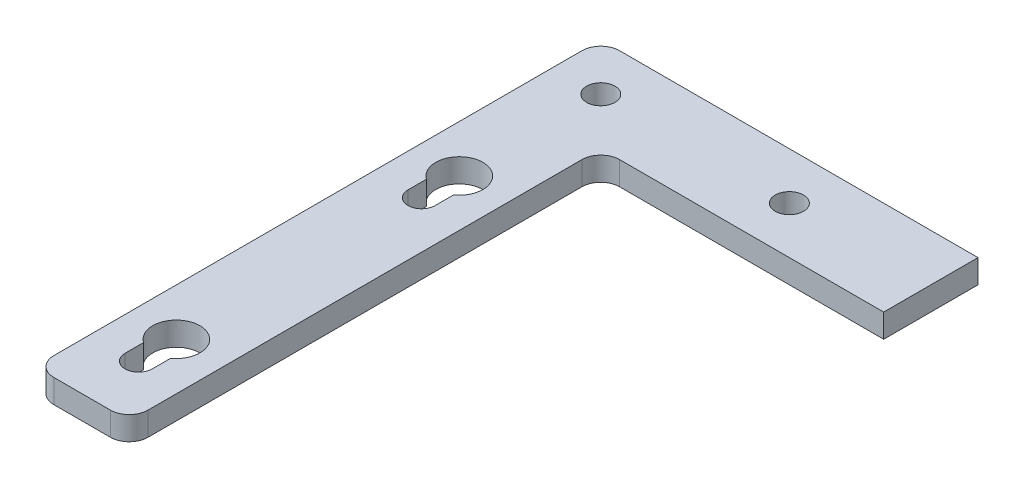
from build123d import *

# Parameters (mm, degrees)
BOSS_EXTRUDE1_DEPTH = 3.175
SKETCH2_R           = 1.905
CUT_EXTRUDE1_DEPTH  = 3.175
FILLET3_R           = 2.54


with BuildPart() as part:
    # Sketch1 → Boss-Extrude1 (new body)
    with BuildSketch(Plane(origin=(0, 0, 0), x_dir=(1, 0, 0), z_dir=(0, 1, 0))):
        Polygon((0, 76.2), (0, 0), (12.7, 0), (12.7, 63.5), (50.8, 63.5), (50.8, 76.2), align=None)
    extrude(amount=BOSS_EXTRUDE1_DEPTH)

    # Sketch2 → Cut-Extrude1 (cut)
    with BuildSketch(Plane(origin=(0, 3.175, 0), x_dir=(1, 0, 0), z_dir=(0, 1, 0))):
        with BuildLine():
            Line((4.5212, 48.204597226), (4.5212, 45.72))
            ThreePointArc((4.5212, 45.72), (6.35, 43.8912), (8.1788, 45.72))
            Line((8.1788, 45.72), (8.1788, 48.204597226))
            ThreePointArc((8.1788, 48.204597226), (6.35, 53.975), (4.5212, 48.204597226))
        make_face()
        with BuildLine():
            Line((4.5212, 10.104597226), (4.5212, 7.62))
            ThreePointArc((4.5212, 7.62), (6.35, 5.7912), (8.1788, 7.62))
            Line((8.1788, 7.62), (8.1788, 10.104597226))
            ThreePointArc((8.1788, 10.104597226), (6.35, 15.875), (4.5212, 10.104597226))
        make_face()
        with Locations(Location((31.75, 69.85, 0), (0, 0, 270))):
            Circle(SKETCH2_R)
        with Locations(Location((6.35, 69.85, 0), (0, 0, 270))):
            Circle(SKETCH2_R)
    extrude(amount=-CUT_EXTRUDE1_DEPTH, mode=Mode.SUBTRACT)

    # Fillet3
    fillet3_edges = [part.edges().sort_by_distance(p)[0] for p in [
        (12.7, 1.5875, -63.5),
        (12.7, 1.5875, 0),
        (0, 1.5875, 0),
        (0, 1.5875, -76.2),
    ]]
    fillet(fillet3_edges, radius=FILLET3_R)


solid = part.part
